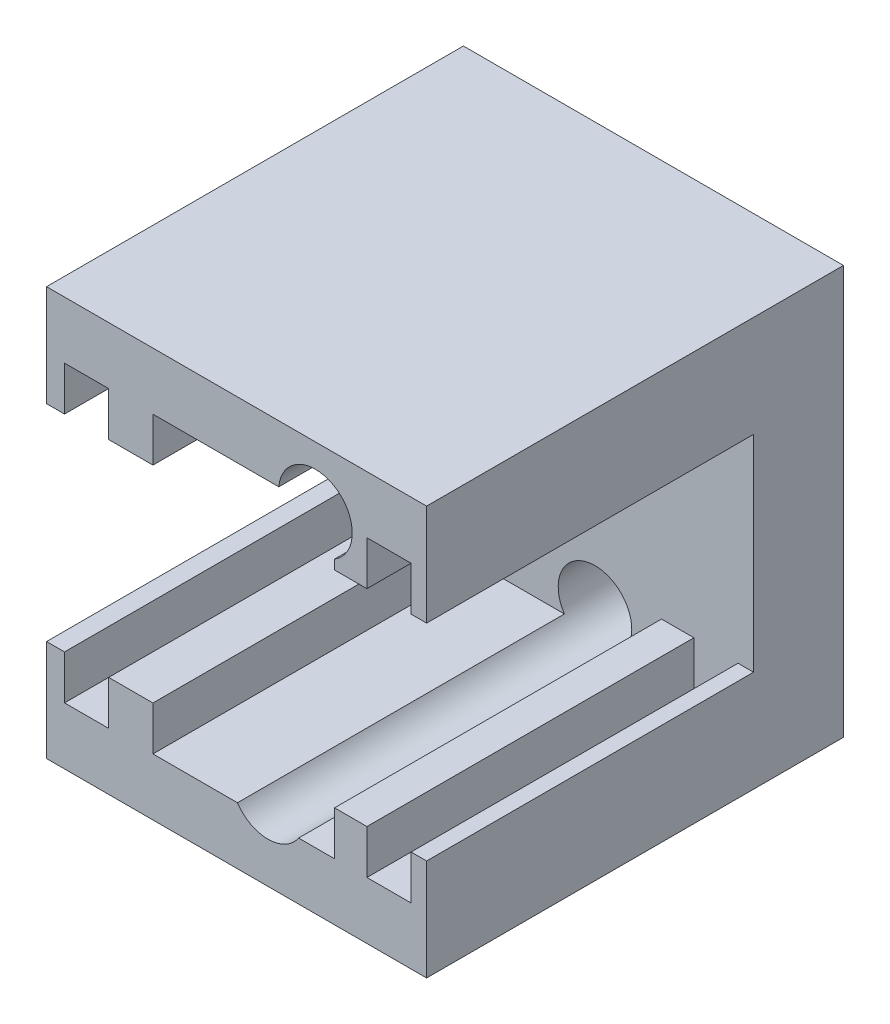
from build123d import *

# Parameters (mm, degrees)
SKETCH1_W           = 50
SKETCH1_H           = 46.5
BOSS_EXTRUDE1_DEPTH = 11
SKETCH2_W           = 46.5
SKETCH2_H           = 12.4
BOSS_EXTRUDE2_DEPTH = 40
SKETCH3_W           = 5.4
SKETCH3_H           = 5.4
SKETCH3_W_2         = 22.221144714
CUT_EXTRUDE1_DEPTH  = 40
SKETCH4_R           = 4.5
CUT_EXTRUDE2_DEPTH  = 47.5
SKETCH5_R           = 2.1
CUT_EXTRUDE3_DEPTH  = 59.496260564


with BuildPart() as part:
    # Sketch1 → Boss-Extrude1 (new body)
    with BuildSketch(Plane(origin=(0, 0, 0), x_dir=(0, 1, 0), z_dir=(0, 0, 1))):
        Rectangle(SKETCH1_W, SKETCH1_H)
    extrude(amount=BOSS_EXTRUDE1_DEPTH)

    # Sketch2 → Boss-Extrude2 (add)
    with BuildSketch(Plane.XY.offset(11)):
        with Locations((0, 18.8)):
            Rectangle(SKETCH2_W, SKETCH2_H)
        with Locations((0, -18.8)):
            Rectangle(SKETCH2_W, SKETCH2_H)
    extrude(amount=BOSS_EXTRUDE2_DEPTH)

    # Sketch3 → Cut-Extrude1 (cut)
    with BuildSketch(Plane.XY.offset(51)):
        with Locations((-18.35, -15.3)):
            Rectangle(SKETCH3_W, SKETCH3_H)
        with Locations((18.65, -15.3)):
            Rectangle(SKETCH3_W, SKETCH3_H)
        with Locations((18.65, 15.3)):
            Rectangle(SKETCH3_W, SKETCH3_H)
        with Locations((-18.35, 15.3)):
            Rectangle(SKETCH3_W, SKETCH3_H)
        with Locations((0.877150449, 15.3)):
            Rectangle(SKETCH3_W_2, SKETCH3_H)
        with Locations((0.877150449, -15.3)):
            Rectangle(SKETCH3_W_2, SKETCH3_H)
    extrude(amount=-CUT_EXTRUDE1_DEPTH, mode=Mode.SUBTRACT)

    # Sketch4 → Cut-Extrude2 (cut)
    with BuildSketch(Plane.XY.offset(51)):
        with Locations((9.65, 17.6)):
            Circle(SKETCH4_R)
        with Locations((3.85, -15.5)):
            Circle(SKETCH4_R)
    extrude(amount=-CUT_EXTRUDE2_DEPTH, mode=Mode.SUBTRACT)

    # Sketch5 → Cut-Extrude3 (cut, through all)
    with BuildSketch(Plane.XY.offset(3.5)):
        with Locations((3.85, -15.5)):
            Circle(SKETCH5_R)
        with Locations((9.65, 17.6)):
            Circle(SKETCH5_R)
    extrude(amount=-CUT_EXTRUDE3_DEPTH, mode=Mode.SUBTRACT)


solid = part.part
